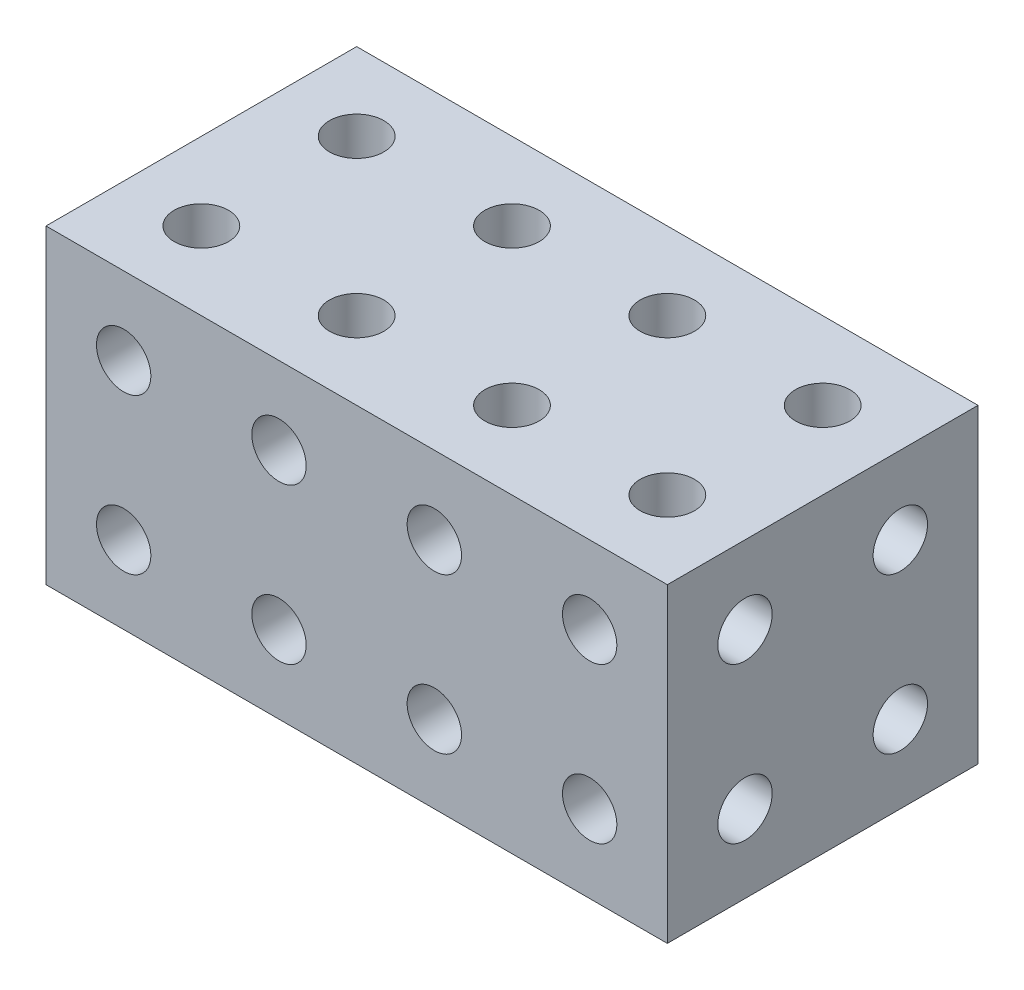
from build123d import *

# Parameters (mm, degrees)
ESQUISSE1_W             = 20
ESQUISSE1_H             = 20
BOSS_EXTRU_1_DEPTH      = 40
ESQUISSE2_R             = 1.75
ENL_V_MAT_EXTRU_1_DEPTH = 49.989794856
ESQUISSE3_R             = 1.75
ENL_V_MAT_EXTRU_2_DEPTH = 40
ESQUISSE4_R             = 1.75
ENL_V_MAT_EXTRU_3_DEPTH = 40


with BuildPart() as part:
    # Esquisse1 → Boss.-Extru.1 (new body)
    with BuildSketch(Plane(origin=(0, 0, 0), x_dir=(0, 0, -1), z_dir=(1, 0, 0))):
        with Locations((10, 10)):
            Rectangle(ESQUISSE1_W, ESQUISSE1_H)
    extrude(amount=BOSS_EXTRU_1_DEPTH)

    # Esquisse2 → Enlèv. mat.-Extru.1 (cut, through all)
    with BuildSketch(Plane(origin=(0, 20, 0), x_dir=(1, 0, 0), z_dir=(0, 1, 0))):
        with Locations(Location((5, 15, 0), (0, 0, 270))):
            Circle(ESQUISSE2_R)
        with Locations(Location((15, 15, 0), (0, 0, 270))):
            Circle(ESQUISSE2_R)
        with Locations(Location((25, 15, 0), (0, 0, 270))):
            Circle(ESQUISSE2_R)
        with Locations(Location((35, 15, 0), (0, 0, 270))):
            Circle(ESQUISSE2_R)
        with Locations(Location((5, 5, 0), (0, 0, 270))):
            Circle(ESQUISSE2_R)
        with Locations(Location((15, 5, 0), (0, 0, 270))):
            Circle(ESQUISSE2_R)
        with Locations(Location((25, 5, 0), (0, 0, 270))):
            Circle(ESQUISSE2_R)
        with Locations(Location((35, 5, 0), (0, 0, 270))):
            Circle(ESQUISSE2_R)
        with Locations((5, -5)):
            Circle(ESQUISSE2_R)
        with Locations((15, -5)):
            Circle(ESQUISSE2_R)
        with Locations((25, -5)):
            Circle(ESQUISSE2_R)
        with Locations((35, -5)):
            Circle(ESQUISSE2_R)
        with Locations((5, -15)):
            Circle(ESQUISSE2_R)
        with Locations((15, -15)):
            Circle(ESQUISSE2_R)
        with Locations((25, -15)):
            Circle(ESQUISSE2_R)
        with Locations((35, -15)):
            Circle(ESQUISSE2_R)
    extrude(amount=-ENL_V_MAT_EXTRU_1_DEPTH, mode=Mode.SUBTRACT)

    # Esquisse3 → Enlèv. mat.-Extru.2 (cut)
    with BuildSketch(Plane.XY):
        with Locations((5, 15)):
            Circle(ESQUISSE3_R)
        with Locations((15, 15)):
            Circle(ESQUISSE3_R)
        with Locations((25, 15)):
            Circle(ESQUISSE3_R)
        with Locations((35, 15)):
            Circle(ESQUISSE3_R)
        with Locations((5, 5)):
            Circle(ESQUISSE3_R)
        with Locations((15, 5)):
            Circle(ESQUISSE3_R)
        with Locations((25, 5)):
            Circle(ESQUISSE3_R)
        with Locations((35, 5)):
            Circle(ESQUISSE3_R)
    extrude(amount=-ENL_V_MAT_EXTRU_2_DEPTH, mode=Mode.SUBTRACT)

    # Esquisse4 → Enlèv. mat.-Extru.3 (cut)
    with BuildSketch(Plane(origin=(40, 0, 0), x_dir=(0, 0, -1), z_dir=(1, 0, 0))):
        with Locations((5, 15)):
            Circle(ESQUISSE4_R)
        with Locations(Location((15, 15, 0), (0, 0, 315))):
            Circle(ESQUISSE4_R)
        with Locations((25, 15)):
            Circle(ESQUISSE4_R)
        with Locations((35, 15)):
            Circle(ESQUISSE4_R)
        with Locations((5, 5)):
            Circle(ESQUISSE4_R)
        with Locations((15, 5)):
            Circle(ESQUISSE4_R)
    extrude(amount=-ENL_V_MAT_EXTRU_3_DEPTH, mode=Mode.SUBTRACT)


solid = part.part
